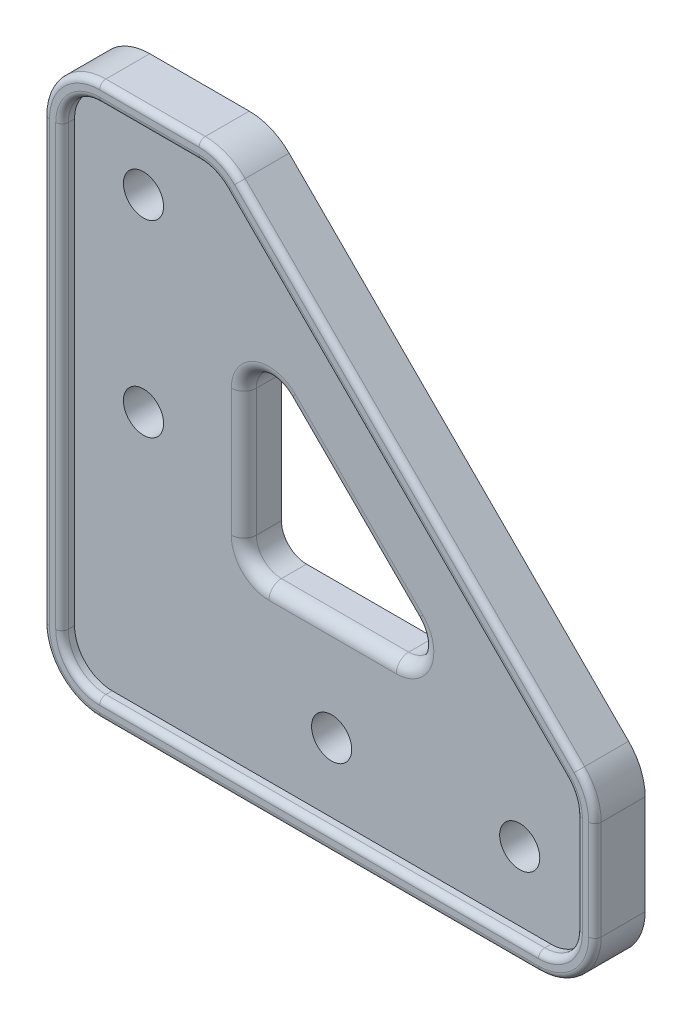
from build123d import *

# Parameters (mm, degrees)
BOSS_EXTRUDE1_DEPTH = 3
SKETCH2_R           = 1.6
CUT_EXTRUDE1_DEPTH  = 64.710281745
MOVE_FACE1_BY       = 0.5
MOVE_FACE1_2_BY     = 0.5
MOVE_FACE1_3_BY     = 0.5
MOVE_FACE1_4_BY     = 0.5
MOVE_FACE1_5_BY     = 0.5
MOVE_FACE1_6_BY     = 0.5
MOVE_FACE1_7_BY     = 0.5
MOVE_FACE1_8_BY     = 0.5
MOVE_FACE1_9_BY     = 0.5
MOVE_FACE1_10_BY    = 0.5
BOSS_EXTRUDE2_DEPTH = 1
FILLET1_R           = 0.5
CUT_EXTRUDE2_DEPTH  = 64.003968129
FILLET2_R           = 1


with BuildPart() as part:
    # Sketch1 → Boss-Extrude1 (new body)
    with BuildSketch(Plane.XY):
        with BuildLine():
            Line((16.464466094, 43.535533906), (43.535533906, 16.464466094))
            ThreePointArc((43.535533906, 16.464466094), (44.619397663, 14.84234935), (45, 12.928932188))
            Line((45, 12.928932188), (45, 5))
            ThreePointArc((45, 5), (43.535533906, 1.464466094), (40, 0))
            Line((40, 0), (5, 0))
            ThreePointArc((5, 0), (1.464466094, 1.464466094), (0, 5))
            Line((0, 5), (0, 40))
            ThreePointArc((0, 40), (1.464466094, 43.535533906), (5, 45))
            Line((5, 45), (12.928932188, 45))
            ThreePointArc((12.928932188, 45), (14.84234935, 44.619397663), (16.464466094, 43.535533906))
        make_face()
    extrude(amount=BOSS_EXTRUDE1_DEPTH)

    # Sketch2 → Cut-Extrude1 (cut, through all)
    with BuildSketch(Plane.XY.offset(3)):
        with Locations((7.5, 37.5)):
            Circle(SKETCH2_R)
        with Locations((7.5, 22.5)):
            Circle(SKETCH2_R)
        with Locations((22.5, 7.5)):
            Circle(SKETCH2_R)
        with Locations((37.5, 7.5)):
            Circle(SKETCH2_R)
    extrude(amount=-CUT_EXTRUDE1_DEPTH, mode=Mode.SUBTRACT)

    # Move Face1: a curved face moved inward by 0.5
    add(Solid.thicken(part.faces().sort_by_distance((1.464466094, 1.464466094, 1.5))[0], -MOVE_FACE1_BY), mode=Mode.SUBTRACT)

    # Move Face1 2: a face moved inward by 0.5
    extrude(part.faces().sort_by_distance((22.5, 0, 1.5))[0], amount=MOVE_FACE1_2_BY, dir=(0, 1, 0), mode=Mode.SUBTRACT)

    # Move Face1 3: a curved face moved inward by 0.5
    add(Solid.thicken(part.faces().sort_by_distance((43.535533906, 1.464466094, 1.5))[0], -MOVE_FACE1_3_BY), mode=Mode.SUBTRACT)

    # Move Face1 4: a face moved inward by 0.5
    extrude(part.faces().sort_by_distance((45, 8.964466094, 1.5))[0], amount=MOVE_FACE1_4_BY, dir=(-1, 0, 0), mode=Mode.SUBTRACT)

    # Move Face1 5: a curved face moved inward by 0.5
    add(Solid.thicken(part.faces().sort_by_distance((44.619397663, 14.84234935, 1.5))[0], -MOVE_FACE1_5_BY), mode=Mode.SUBTRACT)

    # Move Face1 6: a face moved inward by 0.5
    extrude(part.faces().sort_by_distance((30, 30, 1.5))[0], amount=MOVE_FACE1_6_BY, dir=(-0.707106781, -0.707106781, 0), mode=Mode.SUBTRACT)

    # Move Face1 7: a curved face moved inward by 0.5
    add(Solid.thicken(part.faces().sort_by_distance((14.84234935, 44.619397663, 1.5))[0], -MOVE_FACE1_7_BY), mode=Mode.SUBTRACT)

    # Move Face1 8: a face moved inward by 0.5
    extrude(part.faces().sort_by_distance((8.964466094, 45, 1.5))[0], amount=MOVE_FACE1_8_BY, dir=(0, -1, 0), mode=Mode.SUBTRACT)

    # Move Face1 9: a curved face moved inward by 0.5
    add(Solid.thicken(part.faces().sort_by_distance((1.464466094, 43.535533906, 1.5))[0], -MOVE_FACE1_9_BY), mode=Mode.SUBTRACT)

    # Move Face1 10: a face moved inward by 0.5
    extrude(part.faces().sort_by_distance((0, 22.5, 1.5))[0], amount=MOVE_FACE1_10_BY, dir=(1, 0, 0), mode=Mode.SUBTRACT)

    # Sketch3 → Boss-Extrude2 (add)
    with BuildSketch(Plane.XY.offset(3)):
        with BuildLine():
            Line((5, 0.5), (40, 0.5))
            ThreePointArc((40, 0.5), (43.181980515, 1.818019485), (44.5, 5))
            Line((44.5, 5), (44.5, 12.928932188))
            ThreePointArc((44.5, 12.928932188), (44.157457896, 14.651007634), (43.181980515, 16.110912703))
            Line((43.181980515, 16.110912703), (16.110912703, 43.181980515))
            ThreePointArc((16.110912703, 43.181980515), (14.651007634, 44.157457896), (12.928932188, 44.5))
            Line((12.928932188, 44.5), (5, 44.5))
            ThreePointArc((5, 44.5), (1.818019485, 43.181980515), (0.5, 40))
            Line((0.5, 40), (0.5, 5))
            ThreePointArc((0.5, 5), (1.818019485, 1.818019485), (5, 0.5))
        make_face()
        with BuildLine():
            Line((5, 2), (40, 2))
            ThreePointArc((40, 2), (42.121320344, 2.878679656), (43, 5))
            Line((43, 5), (43, 12.928932188))
            ThreePointArc((43, 12.928932188), (42.771638598, 14.076982485), (42.121320344, 15.050252532))
            Line((42.121320344, 15.050252532), (15.050252532, 42.121320344))
            ThreePointArc((15.050252532, 42.121320344), (14.076982485, 42.771638598), (12.928932188, 43))
            Line((12.928932188, 43), (5, 43))
            ThreePointArc((5, 43), (2.878679656, 42.121320344), (2, 40))
            Line((2, 40), (2, 5))
            ThreePointArc((2, 5), (2.878679656, 2.878679656), (5, 2))
        make_face(mode=Mode.SUBTRACT)
    extrude(amount=BOSS_EXTRUDE2_DEPTH)

    # Fillet1
    fillet1_edges = [part.edges().sort_by_distance(p)[0] for p in [
        (1.818019485, 1.818019485, 4),
        (22.5, 0.5, 4),
        (43.181980515, 1.818019485, 4),
        (44.5, 8.964466094, 4),
        (44.157457896, 14.651007634, 4),
        (29.646446609, 29.646446609, 4),
        (14.651007634, 44.157457896, 4),
        (8.964466094, 44.5, 4),
        (1.818019485, 43.181980515, 4),
        (0.5, 22.5, 4),
        (2.878679656, 2.878679656, 4),
        (22.5, 2, 4),
        (42.121320344, 2.878679656, 4),
        (43, 8.964466094, 4),
        (42.771638598, 14.076982485, 4),
        (28.585786438, 28.585786438, 4),
        (14.076982485, 42.771638598, 4),
        (8.964466094, 43, 4),
        (2.878679656, 42.121320344, 4),
        (2, 22.5, 4),
    ]]
    fillet(fillet1_edges, radius=FILLET1_R)

    # Sketch4 → Cut-Extrude2 (cut, through all)
    with BuildSketch(Plane.XY.offset(3)):
        with BuildLine():
            Line((15.5, 27.650757595), (15.5, 17.5))
            ThreePointArc((15.5, 17.5), (16.085786438, 16.085786438), (17.5, 15.5))
            Line((17.5, 15.5), (27.650757595, 15.5))
            ThreePointArc((27.650757595, 15.5), (29.49851666, 16.734633135), (29.064971157, 18.914213562))
            Line((29.064971157, 18.914213562), (18.914213562, 29.064971157))
            ThreePointArc((18.914213562, 29.064971157), (16.734633135, 29.49851666), (15.5, 27.650757595))
        make_face()
    extrude(amount=-CUT_EXTRUDE2_DEPTH, mode=Mode.SUBTRACT)

    # Fillet2
    fillet2_edges = [part.edges().sort_by_distance(p)[0] for p in [
        (16.085786438, 16.085786438, 3),
        (22.575378798, 15.5, 3),
        (29.49851666, 16.734633135, 3),
        (23.98959236, 23.98959236, 3),
        (16.734633135, 29.49851666, 3),
        (15.5, 22.575378798, 3),
    ]]
    fillet(fillet2_edges, radius=FILLET2_R)


solid = part.part
